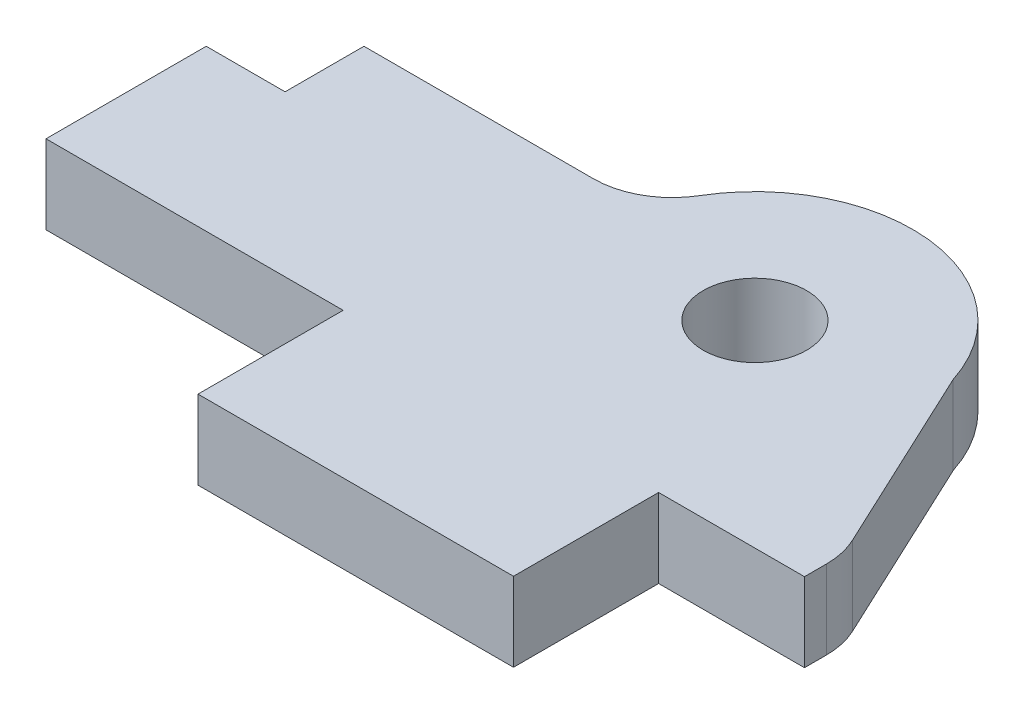
from build123d import *

# Parameters (mm, degrees)
SKETCH1_R           = 2.0828
BOSS_EXTRUDE1_DEPTH = 3.175
FILLET1_R           = 3.175


with BuildPart() as part:
    # Sketch1 → Boss-Extrude1 (new body)
    with BuildSketch(Plane(origin=(0, 0, 0), x_dir=(1, 0, 0), z_dir=(0, 1, 0))):
        with BuildLine():
            Line((-15.950085837, 2.921), (-18.3111574, 2.921))
            Line((-18.3111574, 2.921), (-18.3111574, 9.371))
            Line((-18.3111574, 9.371), (-15.1361574, 9.371))
            Line((-15.1361574, 9.371), (-15.1361574, 12.546))
            Line((-15.1361574, 12.546), (-13.204371576, 12.546))
            Line((-13.204371576, 12.546), (-3.831834579, 12.546))
            ThreePointArc((-3.831834579, 12.546), (2.162458915, 17.20722233), (8.338892533, 12.790185329))
            Line((8.338892533, 12.790185329), (12.221790763, 4.5085))
            Line((12.221790763, 4.5085), (12.221790763, 2.921))
            Line((12.221790763, 2.921), (6.35, 2.921))
            Line((6.35, 2.921), (6.35, -2.921))
            Line((6.35, -2.921), (-6.35, -2.921))
            Line((-6.35, -2.921), (-6.35, 2.921))
            Line((-6.35, 2.921), (-15.950085837, 2.921))
        make_face()
        with Locations(Location((2.289835434, 10.8585, 0), (0, 0, 270))):
            Circle(SKETCH1_R, mode=Mode.SUBTRACT)
    extrude(amount=BOSS_EXTRUDE1_DEPTH)

    # Fillet1
    fillet1_edges = [part.edges().sort_by_distance(p)[0] for p in [
        (-3.831834579, 1.5875, -12.546),
        (12.221790763, 1.5875, -4.5085),
    ]]
    fillet(fillet1_edges, radius=FILLET1_R)


solid = part.part
